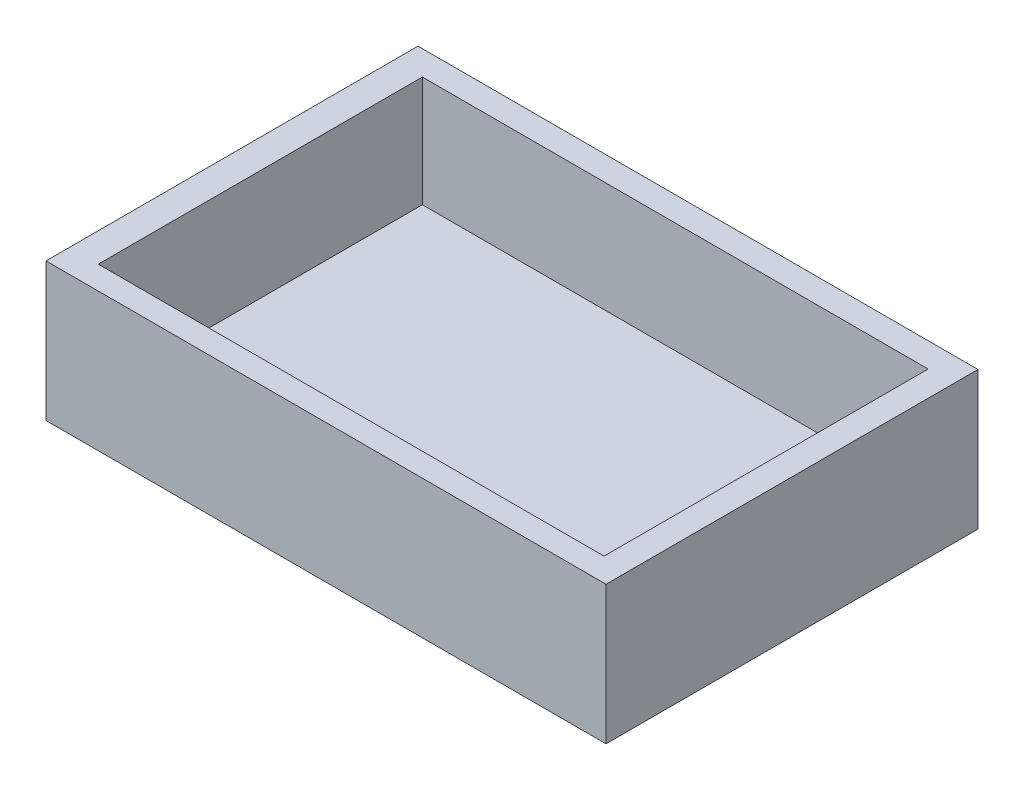
from build123d import *

# Parameters (mm, degrees)
SKETCH1_W           = 202.535444796
SKETCH1_H           = 134.52721946
BOSS_EXTRUDE1_DEPTH = 50
SKETCH2_W           = 182.89884973
SKETCH2_H           = 117.203678168
CUT_EXTRUDE1_DEPTH  = 40


with BuildPart() as part:
    # Sketch1 → Boss-Extrude1 (new body)
    with BuildSketch(Plane(origin=(0, 0, 0), x_dir=(1, 0, 0), z_dir=(0, 1, 0))):
        with Locations((-1.24102601, -10.052310679)):
            Rectangle(SKETCH1_W, SKETCH1_H)
    extrude(amount=BOSS_EXTRUDE1_DEPTH)

    # Sketch2 → Cut-Extrude1 (cut)
    with BuildSketch(Plane(origin=(0, 50, 0), x_dir=(1, 0, 0), z_dir=(0, 1, 0))):
        with Locations((-0.586256858, -10.270567063)):
            Rectangle(SKETCH2_W, SKETCH2_H)
    extrude(amount=-CUT_EXTRUDE1_DEPTH, mode=Mode.SUBTRACT)


solid = part.part
